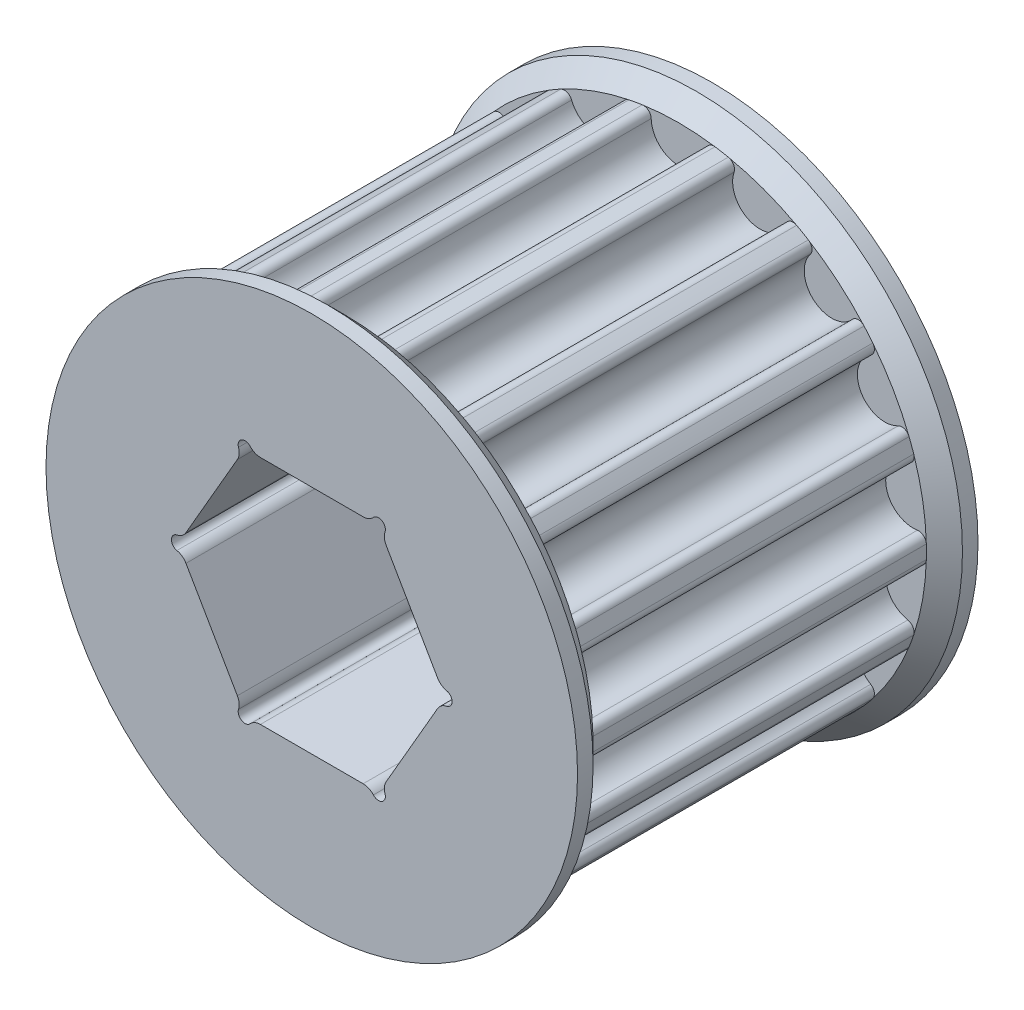
from build123d import *

# Parameters (mm, degrees)
SALIENTE_EXTRUIR1_DEPTH   = 9.25
CROQUIS5_R                = 13.75
SALIENTE_EXTRUIR2_DEPTH   = 1
SALIENTE_EXTRUIR2_DRAFT   = -45
CROQUIS7_R                = 14.75
SALIENTE_EXTRUIR3_DEPTH   = 0.862500027
SIMETR_A1_COPY_1_SKETCH_R = 13.75
SIMETR_A1_COPY_1_DEPTH    = 1
SIMETR_A1_COPY_1_DRAFT    = -45
CORTAR_EXTRUIR1_DEPTH     = 31.48074191
REDONDEO1_R               = 0.762


with BuildPart() as part:
    # Croquis3 → Saliente-Extruir1 (new, symmetric)
    with BuildSketch(Plane.XY):
        with BuildLine():
            ThreePointArc((0, 11.69), (1.067474312, 12.125906986), (1.524693529, 13.184428075))
            ThreePointArc((1.524693529, 13.184428075), (1.677022702, 13.504208303), (2.017706293, 13.601152941))
            ThreePointArc((2.017706293, 13.601152941), (2.387662443, 13.541106604), (2.755844564, 13.470999248))
            ThreePointArc((2.755844564, 13.470999248), (3.042825401, 13.263380437), (3.076596722, 12.91078567))
            ThreePointArc((3.076596722, 12.91078567), (3.144206711, 11.759723032), (3.998215475, 10.985006737))
            ThreePointArc((3.998215475, 10.985006737), (5.150402179, 11.029527598), (5.942083238, 11.867833872))
            ThreePointArc((5.942083238, 11.867833872), (6.194597118, 12.116229347), (6.547891992, 12.090806857))
            ThreePointArc((6.547891992, 12.090806857), (6.875, 11.907849302), (7.196999894, 11.716044235))
            ThreePointArc((7.196999894, 11.716044235), (7.395663854, 11.422793144), (7.306804002, 11.079911971))
            ThreePointArc((7.306804002, 11.079911971), (6.976650002, 9.975142926), (7.514187157, 8.95505954))
            ThreePointArc((7.514187157, 8.95505954), (8.612115532, 8.602824403), (9.642770013, 9.119803753))
            ThreePointArc((9.642770013, 9.119803753), (9.965011698, 9.266854315), (10.288305281, 9.122131025))
            ThreePointArc((10.288305281, 9.122131025), (10.533111093, 8.838329633), (10.770090821, 8.547961377))
            ThreePointArc((10.770090821, 8.547961377), (10.856476097, 8.204448415), (10.655702883, 7.912637366))
            ThreePointArc((10.655702883, 7.912637366), (9.967606338, 6.987413365), (10.12383697, 5.845))
            ThreePointArc((10.12383697, 5.845), (11.03508065, 5.138493621), (12.180396412, 5.271790708))
            ThreePointArc((12.180396412, 5.271790708), (12.5334988, 5.299759889), (12.787797114, 5.053191563))
            ThreePointArc((12.787797114, 5.053191563), (12.920773536, 4.702776971), (13.044149845, 4.348868223))
            ThreePointArc((13.044149845, 4.348868223), (13.007837099, 3.996526122), (12.719366734, 3.790981917))
            ThreePointArc((12.719366734, 3.790981917), (11.756322243, 3.156898629), (11.512402633, 2.029947197))
            ThreePointArc((11.512402633, 2.029947197), (12.127052181, 1.054384672), (13.24888724, 0.7879219))
            ThreePointArc((13.24888724, 0.7879219), (13.590260971, 0.693436203), (13.744891887, 0.374762622))
            ThreePointArc((13.744891887, 0.374762622), (13.75, 0), (13.744891887, -0.374762622))
            ThreePointArc((13.744891887, -0.374762622), (13.590260971, -0.693436203), (13.24888724, -0.7879219))
            ThreePointArc((13.24888724, -0.7879219), (12.127052181, -1.054384672), (11.512402633, -2.029947197))
            ThreePointArc((11.512402633, -2.029947197), (11.756322243, -3.156898629), (12.719366734, -3.790981917))
            ThreePointArc((12.719366734, -3.790981917), (13.007837099, -3.996526122), (13.044149845, -4.348868223))
            ThreePointArc((13.044149845, -4.348868223), (12.920773536, -4.702776971), (12.787797114, -5.053191563))
            ThreePointArc((12.787797114, -5.053191563), (12.5334988, -5.299759889), (12.180396412, -5.271790708))
            ThreePointArc((12.180396412, -5.271790708), (11.03508065, -5.138493621), (10.12383697, -5.845))
            ThreePointArc((10.12383697, -5.845), (9.967606338, -6.987413365), (10.655702883, -7.912637366))
            ThreePointArc((10.655702883, -7.912637366), (10.856476097, -8.204448415), (10.770090821, -8.547961377))
            ThreePointArc((10.770090821, -8.547961377), (10.533111093, -8.838329633), (10.288305281, -9.122131025))
            ThreePointArc((10.288305281, -9.122131025), (9.965011698, -9.266854315), (9.642770013, -9.119803753))
            ThreePointArc((9.642770013, -9.119803753), (8.612115532, -8.602824403), (7.514187157, -8.95505954))
            ThreePointArc((7.514187157, -8.95505954), (6.976650002, -9.975142926), (7.306804002, -11.079911971))
            ThreePointArc((7.306804002, -11.079911971), (7.395663854, -11.422793144), (7.196999894, -11.716044235))
            ThreePointArc((7.196999894, -11.716044235), (6.875, -11.907849302), (6.547891992, -12.090806857))
            ThreePointArc((6.547891992, -12.090806857), (6.194597118, -12.116229347), (5.942083238, -11.867833872))
            ThreePointArc((5.942083238, -11.867833872), (5.150402179, -11.029527598), (3.998215475, -10.985006737))
            ThreePointArc((3.998215475, -10.985006737), (3.144206711, -11.759723032), (3.076596722, -12.91078567))
            ThreePointArc((3.076596722, -12.91078567), (3.042825401, -13.263380437), (2.755844564, -13.470999248))
            ThreePointArc((2.755844564, -13.470999248), (2.387662443, -13.541106604), (2.017706293, -13.601152941))
            ThreePointArc((2.017706293, -13.601152941), (1.677022702, -13.504208303), (1.524693529, -13.184428075))
            ThreePointArc((1.524693529, -13.184428075), (1.067474312, -12.125906986), (0, -11.69))
            ThreePointArc((0, -11.69), (-1.067474312, -12.125906986), (-1.524693529, -13.184428075))
            ThreePointArc((-1.524693529, -13.184428075), (-1.677022702, -13.504208303), (-2.017706293, -13.601152941))
            ThreePointArc((-2.017706293, -13.601152941), (-2.387662443, -13.541106604), (-2.755844564, -13.470999248))
            ThreePointArc((-2.755844564, -13.470999248), (-3.042825401, -13.263380437), (-3.076596722, -12.91078567))
            ThreePointArc((-3.076596722, -12.91078567), (-3.144206711, -11.759723032), (-3.998215475, -10.985006737))
            ThreePointArc((-3.998215475, -10.985006737), (-5.150402179, -11.029527598), (-5.942083238, -11.867833872))
            ThreePointArc((-5.942083238, -11.867833872), (-6.194597118, -12.116229347), (-6.547891992, -12.090806857))
            ThreePointArc((-6.547891992, -12.090806857), (-6.875, -11.907849302), (-7.196999894, -11.716044235))
            ThreePointArc((-7.196999894, -11.716044235), (-7.395663854, -11.422793144), (-7.306804002, -11.079911971))
            ThreePointArc((-7.306804002, -11.079911971), (-6.976650002, -9.975142926), (-7.514187157, -8.95505954))
            ThreePointArc((-7.514187157, -8.95505954), (-8.612115532, -8.602824403), (-9.642770013, -9.119803753))
            ThreePointArc((-9.642770013, -9.119803753), (-9.965011698, -9.266854315), (-10.288305281, -9.122131025))
            ThreePointArc((-10.288305281, -9.122131025), (-10.533111093, -8.838329633), (-10.770090821, -8.547961377))
            ThreePointArc((-10.770090821, -8.547961377), (-10.856476097, -8.204448415), (-10.655702883, -7.912637366))
            ThreePointArc((-10.655702883, -7.912637366), (-9.967606338, -6.987413365), (-10.12383697, -5.845))
            ThreePointArc((-10.12383697, -5.845), (-11.03508065, -5.138493621), (-12.180396412, -5.271790708))
            ThreePointArc((-12.180396412, -5.271790708), (-12.5334988, -5.299759889), (-12.787797114, -5.053191563))
            ThreePointArc((-12.787797114, -5.053191563), (-12.920773536, -4.702776971), (-13.044149845, -4.348868223))
            ThreePointArc((-13.044149845, -4.348868223), (-13.007837099, -3.996526122), (-12.719366734, -3.790981917))
            ThreePointArc((-12.719366734, -3.790981917), (-11.756322243, -3.156898629), (-11.512402633, -2.029947197))
            ThreePointArc((-11.512402633, -2.029947197), (-12.127052181, -1.054384672), (-13.24888724, -0.7879219))
            ThreePointArc((-13.24888724, -0.7879219), (-13.590260971, -0.693436203), (-13.744891887, -0.374762622))
            ThreePointArc((-13.744891887, -0.374762622), (-13.75, 0), (-13.744891887, 0.374762622))
            ThreePointArc((-13.744891887, 0.374762622), (-13.590260971, 0.693436203), (-13.24888724, 0.7879219))
            ThreePointArc((-13.24888724, 0.7879219), (-12.127052181, 1.054384672), (-11.512402633, 2.029947197))
            ThreePointArc((-11.512402633, 2.029947197), (-11.756322243, 3.156898629), (-12.719366734, 3.790981917))
            ThreePointArc((-12.719366734, 3.790981917), (-13.007837099, 3.996526122), (-13.044149845, 4.348868223))
            ThreePointArc((-13.044149845, 4.348868223), (-12.920773536, 4.702776971), (-12.787797114, 5.053191563))
            ThreePointArc((-12.787797114, 5.053191563), (-12.5334988, 5.299759889), (-12.180396412, 5.271790708))
            ThreePointArc((-12.180396412, 5.271790708), (-11.03508065, 5.138493621), (-10.12383697, 5.845))
            ThreePointArc((-10.12383697, 5.845), (-9.967606338, 6.987413365), (-10.655702883, 7.912637366))
            ThreePointArc((-10.655702883, 7.912637366), (-10.856476097, 8.204448415), (-10.770090821, 8.547961377))
            ThreePointArc((-10.770090821, 8.547961377), (-10.533111093, 8.838329633), (-10.288305281, 9.122131025))
            ThreePointArc((-10.288305281, 9.122131025), (-9.965011698, 9.266854315), (-9.642770013, 9.119803753))
            ThreePointArc((-9.642770013, 9.119803753), (-8.612115532, 8.602824403), (-7.514187157, 8.95505954))
            ThreePointArc((-7.514187157, 8.95505954), (-6.976650002, 9.975142926), (-7.306804002, 11.079911971))
            ThreePointArc((-7.306804002, 11.079911971), (-7.395663854, 11.422793144), (-7.196999894, 11.716044235))
            ThreePointArc((-7.196999894, 11.716044235), (-6.875, 11.907849302), (-6.547891992, 12.090806857))
            ThreePointArc((-6.547891992, 12.090806857), (-6.194597118, 12.116229347), (-5.942083238, 11.867833872))
            ThreePointArc((-5.942083238, 11.867833872), (-5.150402179, 11.029527598), (-3.998215475, 10.985006737))
            ThreePointArc((-3.998215475, 10.985006737), (-3.144206711, 11.759723032), (-3.076596722, 12.91078567))
            ThreePointArc((-3.076596722, 12.91078567), (-3.042825401, 13.263380437), (-2.755844564, 13.470999248))
            ThreePointArc((-2.755844564, 13.470999248), (-2.387662443, 13.541106604), (-2.017706293, 13.601152941))
            ThreePointArc((-2.017706293, 13.601152941), (-1.677022702, 13.504208303), (-1.524693529, 13.184428075))
            ThreePointArc((-1.524693529, 13.184428075), (-1.067474312, 12.125906986), (0, 11.69))
        make_face()
    extrude(amount=SALIENTE_EXTRUIR1_DEPTH, both=True)


with BuildPart() as saliente_extruir2_tool:
    # Croquis5 → Saliente-Extruir2 (with draft: the straight prism first)
    with BuildSketch(Plane.XY.offset(9.25)):
        Circle(CROQUIS5_R)
    extrude(amount=SALIENTE_EXTRUIR2_DEPTH)
    # Saliente-Extruir2: the draft: its side faces are tilted about the plane it starts from
    saliente_extruir2_sides = [saliente_extruir2_tool.faces().sort_by_distance(p)[0] for p in [
        (-13.75, 0, 9.75),
    ]]
    draft(saliente_extruir2_sides, Plane.XY.offset(9.25), SALIENTE_EXTRUIR2_DRAFT)


with BuildPart() as part_1:
    add(part.part)

    # Saliente-Extruir2: add saliente_extruir2_tool
    add(saliente_extruir2_tool.part)

    # Croquis7 → Saliente-Extruir3 (add)
    with BuildSketch(Plane.XY.offset(10.25)):
        Circle(CROQUIS7_R)
    saliente_extruir3 = extrude(amount=SALIENTE_EXTRUIR3_DEPTH)


with BuildPart() as simetr_a1_1:
    # Simetría1: Saliente-Extruir3 across plane
    add(saliente_extruir3.mirror(Plane.XY))


with BuildPart() as simetr_a1_copy_1_tool:
    # Simetría1 copy 1 sketch → Simetría1 copy 1 (with draft: the straight prism first)
    with BuildSketch(Plane(origin=(0, 0, -9.25), x_dir=(1, 0, 0), z_dir=(0, 0, -1))):
        Circle(SIMETR_A1_COPY_1_SKETCH_R)
    extrude(amount=SIMETR_A1_COPY_1_DEPTH)
    # Simetría1 copy 1: the draft: its side faces are tilted about the plane it starts from
    simetr_a1_copy_1_sides = [simetr_a1_copy_1_tool.faces().sort_by_distance(p)[0] for p in [
        (-13.75, 0, -9.75),
    ]]
    draft(simetr_a1_copy_1_sides, Plane(origin=(0, 0, -9.25), x_dir=(1, 0, 0), z_dir=(0, 0, -1)), SIMETR_A1_COPY_1_DRAFT)


with BuildPart() as part_2:
    add(part_1.part)

    # Simetría1 copy 1: add simetr_a1_copy_1_tool
    add(simetr_a1_copy_1_tool.part)

    add(simetr_a1_1.part)  # Simetría1 copy 1 merges Simetría1_1

    # Croquis6 → Cortar-Extruir1 (cut, through all)
    with BuildSketch(Plane.XY.offset(11.112500027)):
        Polygon((-7.407403954, 0), (-3.703701977, -6.415), (3.703701977, -6.415), (7.407403954, 0), (3.703701977, 6.415), (-3.703701977, 6.415), align=None)
        with BuildLine():
            Line((7.407403954, 0), (7.216903954, -0.329955679))
            ThreePointArc((7.216903954, -0.329955679), (7.788403954, 0), (7.216903954, 0.329955679))
            Line((7.216903954, 0.329955679), (7.407403954, 0))
        make_face()
        with BuildLine():
            Line((3.703701977, 6.415), (3.894201977, 6.085044321))
            ThreePointArc((3.894201977, 6.085044321), (3.894201977, 6.744955679), (3.322701977, 6.415))
            Line((3.322701977, 6.415), (3.703701977, 6.415))
        make_face()
        with BuildLine():
            Line((-3.703701977, 6.415), (-3.322701977, 6.415))
            ThreePointArc((-3.322701977, 6.415), (-3.894201977, 6.744955679), (-3.894201977, 6.085044321))
            Line((-3.894201977, 6.085044321), (-3.703701977, 6.415))
        make_face()
        with BuildLine():
            ThreePointArc((-7.216903954, 0.329955679), (-7.788403954, 0), (-7.216903954, -0.329955679))
            Line((-7.216903954, -0.329955679), (-7.407403954, 0))
            Line((-7.407403954, 0), (-7.216903954, 0.329955679))
        make_face()
        with BuildLine():
            ThreePointArc((-3.894201977, -6.085044321), (-3.894201977, -6.744955679), (-3.322701977, -6.415))
            Line((-3.322701977, -6.415), (-3.703701977, -6.415))
            Line((-3.703701977, -6.415), (-3.894201977, -6.085044321))
        make_face()
        with BuildLine():
            Line((3.894201977, -6.085044321), (3.703701977, -6.415))
            Line((3.703701977, -6.415), (3.322701977, -6.415))
            ThreePointArc((3.322701977, -6.415), (3.894201977, -6.744955679), (3.894201977, -6.085044321))
        make_face()
    extrude(amount=-CORTAR_EXTRUIR1_DEPTH, mode=Mode.SUBTRACT)

    # Redondeo1
    redondeo1_edges = [part_2.edges().sort_by_distance(p)[0] for p in [
        (-7.216903954, -0.329955679, 0),
        (-7.216903954, 0.329955679, 0),
        (-3.894201977, 6.085044321, 0),
        (-3.322701977, 6.415, 0),
        (3.322701977, 6.415, 0),
        (3.894201977, 6.085044321, 0),
        (7.216903954, 0.329955679, 0),
        (7.216903954, -0.329955679, 0),
        (3.894201977, -6.085044321, 0),
        (3.322701977, -6.415, 0),
        (-3.322701977, -6.415, 0),
        (-3.894201977, -6.085044321, 0),
    ]]
    fillet(redondeo1_edges, radius=REDONDEO1_R)


solid = part_2.part
